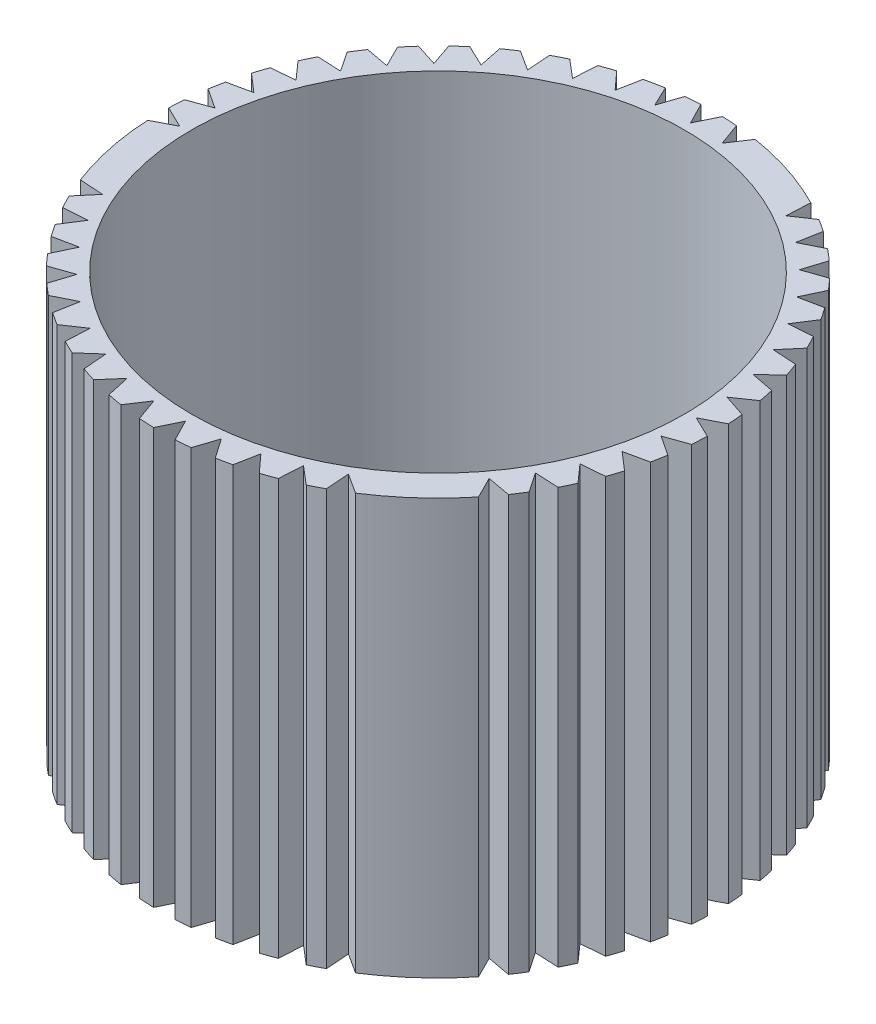
from build123d import *

# Parameters (mm, degrees)
SKETCH1_R           = 27.131966011
BOSS_EXTRUDE1_DEPTH = 45.77


with BuildPart() as part:
    # Sketch1 → Boss-Extrude1 (new body)
    with BuildSketch(Plane(origin=(0, 0, 0), x_dir=(1, 0, 0), z_dir=(0, 1, 0))):
        with BuildLine():
            Line((-3.984261156, 27.848398027), (-3.155526874, 30.336328812))
            ThreePointArc((-3.155526874, 30.336328812), (-2.335703763, 30.410437264), (-1.5141793, 30.462394497))
            Line((-1.5141793, 30.462394497), (-0.315230151, 28.130201914))
            Line((-0.315230151, 28.130201914), (0.831154566, 30.48867707))
            ThreePointArc((0.831154566, 30.48867707), (1.65363686, 30.455143124), (2.474914637, 30.399425407))
            Line((2.474914637, 30.399425407), (3.359194573, 27.930690283))
            Line((3.359194573, 27.930690283), (4.803614875, 30.119355554))
            ThreePointArc((4.803614875, 30.119355554), (9.479661295, 28.989418191), (13.919878882, 27.138300594))
            Line((13.919878882, 27.138300594), (13.792102919, 24.51908612))
            Line((13.792102919, 24.51908612), (15.964140245, 25.988394149))
            ThreePointArc((15.964140245, 25.988394149), (16.659663243, 25.548112068), (17.343051232, 25.089220567))
            Line((17.343051232, 25.089220567), (16.874492259, 22.509091617))
            Line((16.874492259, 22.509091617), (19.21973095, 23.682321883))
            ThreePointArc((19.21973095, 23.682321883), (19.851835217, 23.155022565), (20.469479277, 22.610856977))
            Line((20.469479277, 22.610856977), (19.668154402, 20.113960352))
            Line((19.668154402, 20.113960352), (22.146466743, 20.971038467))
            ThreePointArc((22.146466743, 20.971038467), (22.704336831, 20.365744156), (23.245668935, 19.745615304))
            Line((23.245668935, 19.745615304), (22.125289014, 17.374673686))
            Line((22.125289014, 17.374673686), (24.69427034, 17.900934736))
            ThreePointArc((24.69427034, 17.900934736), (25.168360968, 17.228002177), (25.624118803, 16.542520632))
            Line((25.624118803, 16.542520632), (24.203853841, 14.338101571))
            Line((24.203853841, 14.338101571), (26.8195481, 14.52454104))
            ThreePointArc((26.8195481, 14.52454104), (27.201747469, 13.795484281), (27.564132913, 13.056378805))
            Line((27.564132913, 13.056378805), (25.868284062, 11.0562006))
            Line((25.868284062, 11.0562006), (28.485935925, 10.899628442))
            ThreePointArc((28.485935925, 10.899628442), (28.769704511, 10.126921824), (29.032517063, 9.346838694))
            Line((29.032517063, 9.346838694), (27.090100815, 7.585125008))
            Line((27.090100815, 7.585125008), (29.664921456, 7.088220232))
            ThreePointArc((29.664921456, 7.088220232), (29.845403904, 6.285084953), (30.00414677, 5.47737158))
            Line((30.00414677, 5.47737158), (27.848398476, 3.984265861))
            Line((27.848398476, 3.984265861), (30.336331931, 3.15553069))
            ThreePointArc((30.336331931, 3.15553069), (30.410440131, 2.33570859), (30.462397167, 1.514185147))
            Line((30.462397167, 1.514185147), (28.130202362, 0.315234856))
            Line((28.130202362, 0.315234856), (30.488679348, -0.83115075))
            ThreePointArc((30.488679348, -0.83115075), (30.455145268, -1.653632314), (30.399427457, -2.474909359))
            Line((30.399427457, -2.474909359), (27.930690731, -3.359189868))
            Line((27.930690731, -3.359189868), (30.11935702, -4.803610841))
            ThreePointArc((30.11935702, -4.803610841), (29.97875441, -5.614679004), (29.81631507, -6.421657392))
            Line((29.81631507, -6.421657392), (27.253277282, -6.976137886))
            Line((27.253277282, -6.976137886), (29.234684181, -8.693879674))
            ThreePointArc((29.234684181, -8.693879674), (28.989418755, -9.479656851), (28.723037229, -10.258528973))
            Line((28.723037229, -10.258528973), (26.109552746, -10.473722214))
            Line((26.109552746, -10.473722214), (27.849797859, -12.435393664))
            ThreePointArc((27.849797859, -12.435393664), (27.504066132, -13.182434995), (27.138300238, -13.919874138))
            Line((27.138300238, -13.919874138), (24.519086569, -13.792098214))
            Line((24.519086569, -13.792098214), (25.988393872, -15.964134468))
            ThreePointArc((25.988393872, -15.964134468), (25.548111361, -16.659657866), (25.089219408, -17.343046235))
            Line((25.089219408, -17.343046235), (22.509092066, -16.874487554))
            Line((22.509092066, -16.874487554), (23.682321388, -19.219724361))
            ThreePointArc((23.682321388, -19.219724361), (20.365742572, -22.704330231), (16.542517807, -25.624111989))
            Line((16.542517807, -25.624111989), (14.33810202, -24.203849136))
            Line((14.33810202, -24.203849136), (14.524541185, -26.819539129))
            ThreePointArc((14.524541185, -26.819539129), (13.795482869, -27.201739208), (13.056375797, -27.564125279))
            Line((13.056375797, -27.564125279), (11.056201049, -25.868279357))
            Line((11.056201049, -25.868279357), (10.899629182, -28.485926359))
            ThreePointArc((10.899629182, -28.485926359), (10.126920725, -28.76969554), (9.346835723, -29.032508588))
            Line((9.346835723, -29.032508588), (7.585125457, -27.09009611))
            Line((7.585125457, -27.09009611), (7.0882217, -29.66491147))
            ThreePointArc((7.0882217, -29.66491147), (6.285084339, -29.845394329), (5.477368862, -30.004137493))
            Line((5.477368862, -30.004137493), (3.984266309, -27.848393771))
            Line((3.984266309, -27.848393771), (3.15553297, -30.336321728))
            ThreePointArc((3.15553297, -30.336321728), (2.3357086, -30.410430097), (1.51418288, -30.462387181))
            Line((1.51418288, -30.462387181), (0.315235305, -28.130197658))
            Line((0.315235305, -28.130197658), (-0.831147629, -30.488669145))
            ThreePointArc((-0.831147629, -30.488669145), (-1.653631581, -30.455134954), (-2.474911005, -30.399416902))
            Line((-2.474911005, -30.399416902), (-3.35918942, -27.930686027))
            Line((-3.35918942, -27.930686027), (-4.803606908, -30.119347035))
            ThreePointArc((-4.803606908, -30.119347035), (-5.614677501, -29.978744012), (-6.421658293, -29.816304126))
            Line((-6.421658293, -29.816304126), (-6.976137437, -27.253272577))
            Line((-6.976137437, -27.253272577), (-8.693875013, -29.234674617))
            ThreePointArc((-8.693875013, -29.234674617), (-9.479654581, -28.989408474), (-10.258529053, -28.723026103))
            Line((-10.258529053, -28.723026103), (-10.473721765, -26.109548042))
            Line((-10.473721765, -26.109548042), (-12.435388408, -27.84978889))
            ThreePointArc((-12.435388408, -27.84978889), (-13.182432016, -27.504056163), (-13.919873378, -27.138289149))
            Line((-13.919873378, -27.138289149), (-13.792097766, -24.519081864))
            Line((-13.792097766, -24.519081864), (-15.964128792, -25.988385631))
            ThreePointArc((-15.964128792, -25.988385631), (-16.659654283, -25.548101878), (-17.343044673, -25.089208572))
            Line((-17.343044673, -25.089208572), (-16.874487106, -22.509087361))
            Line((-16.874487106, -22.509087361), (-19.219718467, -23.68231396))
            ThreePointArc((-19.219718467, -23.68231396), (-19.851825173, -23.155012543), (-20.469471557, -22.610844724))
            Line((-20.469471557, -22.610844724), (-19.668149248, -20.113956096))
            Line((-19.668149248, -20.113956096), (-22.146453419, -20.971031386))
            ThreePointArc((-22.146453419, -20.971031386), (-22.704325784, -20.365734574), (-23.245660027, -19.745603103))
            Line((-23.245660027, -19.745603103), (-22.125283861, -17.374669429))
            Line((-22.125283861, -17.374669429), (-24.694256422, -17.900928684))
            ThreePointArc((-24.694256422, -17.900928684), (-25.168349066, -17.227993282), (-25.62410876, -16.542508787))
            Line((-25.62410876, -16.542508787), (-24.203848687, -14.338097315))
            Line((-24.203848687, -14.338097315), (-26.819533875, -14.524536138))
            ThreePointArc((-26.819533875, -14.524536138), (-27.201734918, -13.79547627), (-27.564121868, -13.056367599))
            Line((-27.564121868, -13.056367599), (-25.868278909, -11.056196344))
            Line((-25.868278909, -11.056196344), (-28.4859217, -10.899624729))
            ThreePointArc((-28.4859217, -10.899624729), (-29.845390828, -6.285079097), (-30.462384511, -1.514177033))
            Line((-30.462384511, -1.514177033), (-28.130197209, -0.3152306))
            Line((-28.130197209, -0.3152306), (-30.488666867, 0.831151445))
            ThreePointArc((-30.488666867, 0.831151445), (-30.455132809, 1.653636127), (-30.399414852, 2.474916284))
            Line((-30.399414852, 2.474916284), (-27.930685578, 3.359194124))
            Line((-27.930685578, 3.359194124), (-30.119345569, 4.803610941))
            ThreePointArc((-30.119345569, 4.803610941), (-29.978742638, 5.614681962), (-29.816302822, 6.421663183))
            Line((-29.816302822, 6.421663183), (-27.253272129, 6.976142142))
            Line((-27.253272129, 6.976142142), (-29.23467388, 8.693879467))
            ThreePointArc((-29.23467388, 8.693879467), (-28.989407866, 9.479659161), (-28.72302562, 10.258533761))
            Line((-28.72302562, 10.258533761), (-26.109547593, 10.47372647))
            Line((-26.109547593, 10.47372647), (-27.849788746, 12.435393457))
            ThreePointArc((-27.849788746, 12.435393457), (-27.504056265, 13.182436908), (-27.138289505, 13.919878122))
            Line((-27.138289505, 13.919878122), (-24.519081415, 13.792102471))
            Line((-24.519081415, 13.792102471), (-25.988385908, 15.964134569))
            ThreePointArc((-25.988385908, 15.964134569), (-25.548102584, 16.65965966), (-25.089209731, 17.34304967))
            Line((-25.089209731, 17.34304967), (-22.509086912, 16.87449181))
            Line((-22.509086912, 16.87449181), (-23.682314454, 19.219725057))
            ThreePointArc((-23.682314454, 19.219725057), (-23.155013707, 19.851831175), (-22.610846592, 20.469477005))
            Line((-22.610846592, 20.469477005), (-20.113955647, 19.668153953))
            Line((-20.113955647, 19.668153953), (-20.97103188, 22.14646085))
            ThreePointArc((-20.97103188, 22.14646085), (-20.36573602, 22.704332508), (-19.745605539, 23.245666095))
            Line((-19.745605539, 23.245666095), (-17.374668981, 22.125288565))
            Line((-17.374668981, 22.125288565), (-17.90092896, 24.694264665))
            ThreePointArc((-17.90092896, 24.694264665), (-17.227994811, 25.168356561), (-16.542511612, 25.624115574))
            Line((-16.542511612, 25.624115574), (-14.338096867, 24.203853392))
            Line((-14.338096867, 24.203853392), (-14.524535993, 26.819542846))
            ThreePointArc((-14.524535993, 26.819542846), (-13.795477682, 27.20174318), (-13.056370606, 27.564129503))
            Line((-13.056370606, 27.564129503), (-11.056195896, 25.868283613))
            Line((-11.056195896, 25.868283613), (-10.89962399, 28.485931265))
            ThreePointArc((-10.89962399, 28.485931265), (-10.126915935, 28.769700534), (-9.346831335, 29.032513688))
            Line((-9.346831335, 29.032513688), (-7.585120303, 27.090100366))
            Line((-7.585120303, 27.090100366), (-7.088216199, 29.664917524))
            ThreePointArc((-7.088216199, 29.664917524), (-6.06936901, 29.890013635), (-5.043418528, 30.08012798))
            Line((-5.043418528, 30.08012798), (-3.984261156, 27.848398027))
        make_face()
        with Locations(Location((2.577e-06, 2.128e-06, 0), (0, 0, 270))):
            Circle(SKETCH1_R, mode=Mode.SUBTRACT)
    extrude(amount=BOSS_EXTRUDE1_DEPTH)


solid = part.part
